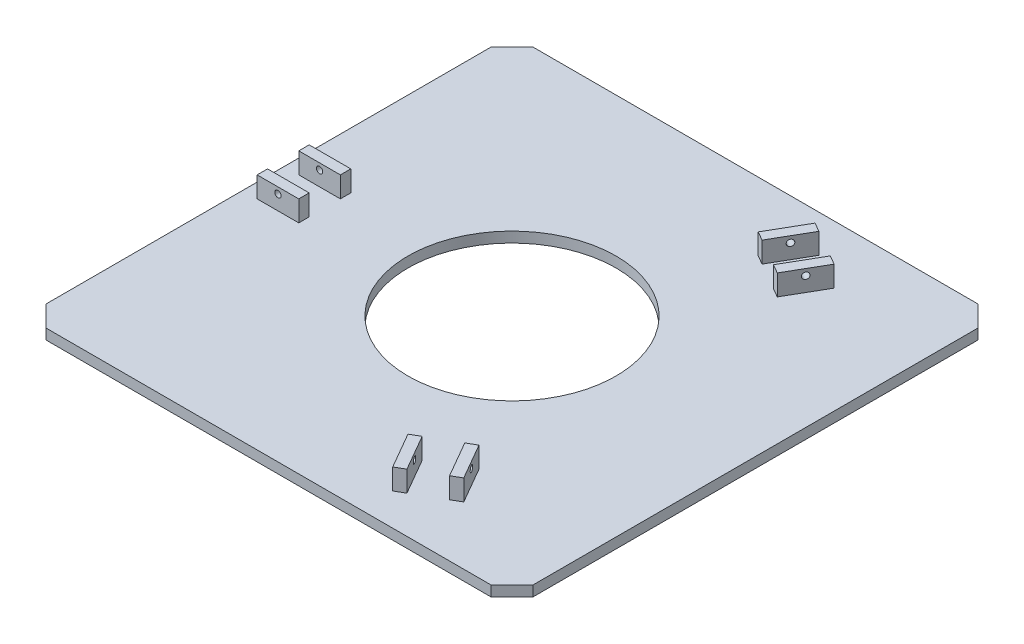
from build123d import *

# Parameters (mm, degrees)
BOSS_EXTRUDE1_DEPTH   = 10
BOSS_EXTRUDE1_2_DEPTH = 10
BOSS_EXTRUDE1_3_DEPTH = 10
BOSS_EXTRUDE1_4_DEPTH = 10
SKETCH1_W             = 20
SKETCH1_H             = 5
BOSS_EXTRUDE1_5_DEPTH = 10
BOSS_EXTRUDE1_6_DEPTH = 10
SKETCH2_R             = 50
BOSS_EXTRUDE2_DEPTH   = 5
SKETCH3_R             = 1.525
CUT_EXTRUDE1_DEPTH    = 30
SKETCH4_R             = 1.525
CUT_EXTRUDE2_DEPTH    = 30
SKETCH5_R             = 1.525
CUT_EXTRUDE3_DEPTH    = 30


with BuildPart() as part:
    # Sketch1 → Boss-Extrude1 (new body)
    with BuildSketch(Plane(origin=(0, 0, 0), x_dir=(1, 0, 0), z_dir=(0, 1, 0))):
        Polygon((44.174682453, 101.512794416), (34.174682453, 84.192286341), (38.504809472, 81.692286341), (48.504809472, 99.012794416), align=None)
    extrude(amount=BOSS_EXTRUDE1_DEPTH)



with BuildPart() as body_2:
    # Sketch1 → Boss-Extrude1 2 (new body)
    with BuildSketch(Plane(origin=(0, 0, 0), x_dir=(1, 0, 0), z_dir=(0, 1, 0))):
        Polygon((61.495190528, 91.512794416), (65.825317547, 89.012794416), (55.825317547, 71.692286341), (51.495190528, 74.192286341), align=None)
    extrude(amount=BOSS_EXTRUDE1_2_DEPTH)


with BuildPart() as body_3:
    # Sketch1 → Boss-Extrude1 3 (new body)
    with BuildSketch(Plane(origin=(0, 0, 0), x_dir=(1, 0, 0), z_dir=(0, 1, 0))):
        Polygon((65.825317547, -89.012794416), (55.825317547, -71.692286341), (51.495190528, -74.192286341), (61.495190528, -91.512794416), align=None)
    extrude(amount=BOSS_EXTRUDE1_3_DEPTH)


with BuildPart() as body_4:
    # Sketch1 → Boss-Extrude1 4 (new body)
    with BuildSketch(Plane(origin=(0, 0, 0), x_dir=(1, 0, 0), z_dir=(0, 1, 0))):
        Polygon((48.504809472, -99.012794416), (44.174682453, -101.512794416), (34.174682453, -84.192286341), (38.504809472, -81.692286341), align=None)
    extrude(amount=BOSS_EXTRUDE1_4_DEPTH)


with BuildPart() as body_5:
    # Sketch1 → Boss-Extrude1 5 (new body)
    with BuildSketch(Plane(origin=(0, 0, 0), x_dir=(1, 0, 0), z_dir=(0, 1, 0))):
        with Locations((-100, -10)):
            Rectangle(SKETCH1_W, SKETCH1_H)
    extrude(amount=BOSS_EXTRUDE1_5_DEPTH)


with BuildPart() as body_6:
    # Sketch1 → Boss-Extrude1 6 (new body)
    with BuildSketch(Plane(origin=(0, 0, 0), x_dir=(1, 0, 0), z_dir=(0, 1, 0))):
        with Locations((-100, 10)):
            Rectangle(SKETCH1_W, SKETCH1_H)
    extrude(amount=BOSS_EXTRUDE1_6_DEPTH)


with BuildPart() as part_1:
    add(part.part)

    add(body_2.part)  # Boss-Extrude2 merges body 2

    add(body_3.part)  # Boss-Extrude2 merges body 3

    add(body_4.part)  # Boss-Extrude2 merges body 4

    add(body_5.part)  # Boss-Extrude2 merges body 5

    add(body_6.part)  # Boss-Extrude2 merges body 6
    # Sketch2 → Boss-Extrude2 (add)
    with BuildSketch(Plane(origin=(0, 0, 0), x_dir=(1, 0, 0), z_dir=(0, 1, 0))):
        Polygon((-117, 107), (-107, 117), (107, 117), (117, 107), (117, -107), (107, -117), (-107, -117), (-117, -107), align=None)
        with Locations(Location((0, 0, 0), (0, 0, 270))):
            Circle(SKETCH2_R, mode=Mode.SUBTRACT)
    extrude(amount=-BOSS_EXTRUDE2_DEPTH)

    # Sketch3 → Cut-Extrude1 (cut)
    with BuildSketch(Plane.XY.offset(12.5)):
        with Locations((-100, 7)):
            Circle(SKETCH3_R)
    extrude(amount=-CUT_EXTRUDE1_DEPTH, mode=Mode.SUBTRACT)

    # Sketch4 → Cut-Extrude2 (cut)
    with BuildSketch(Plane(origin=(10.825317547, 0, -6.25), x_dir=(-0.5000000000000004, 0, -0.8660254037844385), z_dir=(0.8660254037844384, 0, -0.5000000000000003))):
        with Locations((-100, 7)):
            Circle(SKETCH4_R)
    extrude(amount=-CUT_EXTRUDE2_DEPTH, mode=Mode.SUBTRACT)

    # Sketch5 → Cut-Extrude3 (cut)
    with BuildSketch(Plane(origin=(-10.825317547, 0, -6.25), x_dir=(-0.5000000000000001, 0, 0.8660254037844386), z_dir=(-0.8660254037844386, 0, -0.5000000000000001))):
        with Locations((-100, 7)):
            Circle(SKETCH5_R)
    extrude(amount=-CUT_EXTRUDE3_DEPTH, mode=Mode.SUBTRACT)


solid = part_1.part
